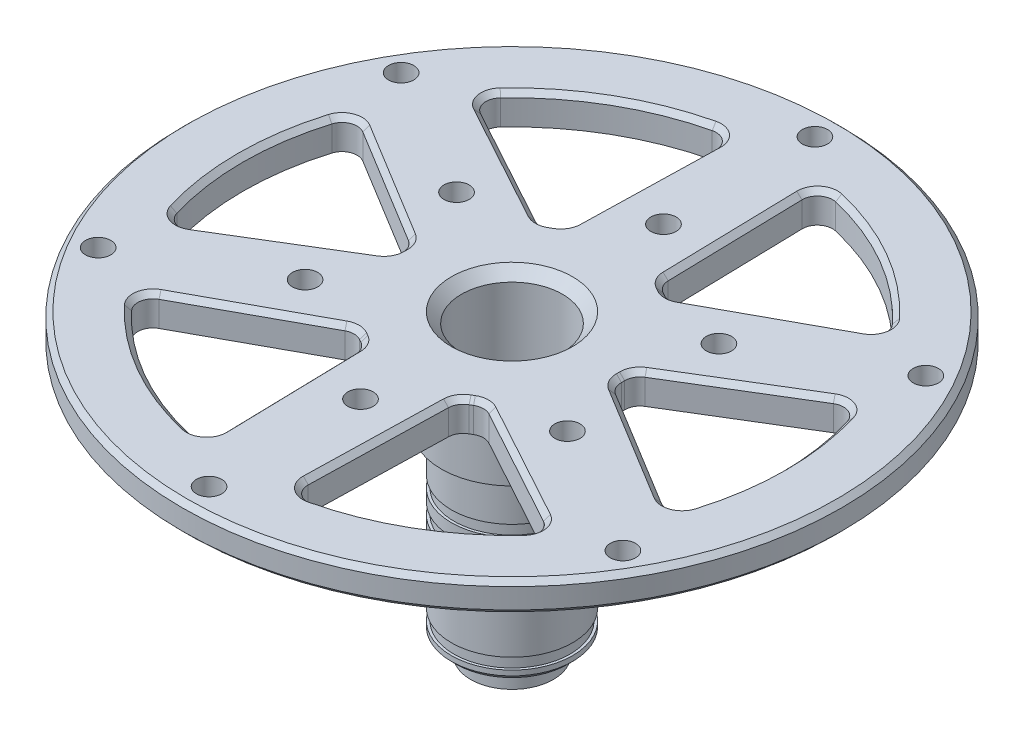
from build123d import *

# Parameters (mm, degrees)
CIRPATTERN1_COUNT        = 3
CHAMFER1_SIZE            = 0.5
CHAMFER2_SIZE            = 1
CUT_EXTRUDE1_DEPTH       = 51.319429647
FILLET1_R                = 1.5
M3X0_5_TAPPED_HOLE1_D    = 2.5
CIRPATTERN2_COUNT        = 6
FILLET1_OF_CIRPATTERN2_R = 1.5
SKETCH10_W               = 1.207732619
SKETCH10_H               = 1.1
SKETCH11_W               = 3.151954219
SKETCH11_H               = 1.1
M3X0_5_TAPPED_HOLE2_D    = 2.5
CIRPATTERN3_COUNT        = 6
CHAMFER3_SIZE            = 0.5


with BuildPart() as part:
    # Sketch2 → Revolve1 (revolve)
    with BuildSketch(Plane.XY):
        Polygon((-4, 10), (-4, -6.5), (-3.1, -6.5), (-3.1, -9.5), (-4.1, -9.5), (-4.1, -7.5), (-6, -7.5), (-6, 10), (-7, 10), (-7, 17), (-32.65, 17), (-32.65, 20), (-5, 20), (-5, 11), align=None)
    revolve(axis=Axis((0, 0, 0), (0, -1, 0)))

    # Sketch3 → Revolve2 (revolve)
    with BuildSketch(Plane.XY):
        Polygon((-21.598, 15), (-22.598, 15), (-22.598, 17), (-20.098, 17), (-20.098, 11), (-21.598, 11), align=None)
    revolve2 = revolve(axis=Axis((-20.098, 18.273035546, 0), (0, -1, 0)))

    # CirPattern1: Revolve2 ×3 about axis
    cirpattern1_axis = Axis((0, 0, 0), (0, 1, 0))
    for i in range(1, CIRPATTERN1_COUNT):
        add(revolve2.rotate(cirpattern1_axis, i * 360 / CIRPATTERN1_COUNT))

    # Chamfer1
    chamfer1_edges = [part.edges().sort_by_distance(p)[0] for p in [
        (32.65, 20, 0),
        (32.65, 17, 0),
    ]]
    chamfer(chamfer1_edges, length=CHAMFER1_SIZE)

    # Chamfer2
    chamfer2_edges = [part.edges().sort_by_distance(p)[0] for p in [
        (5, 20, 0),
    ]]
    chamfer(chamfer2_edges, length=CHAMFER2_SIZE)

    # Sketch6 → Cut-Extrude1 (cut, through all)
    with BuildSketch(Plane(origin=(0, 0, 0), x_dir=(1, 0, 0), z_dir=(0, 1, 0))):
        with BuildLine():
            Line((24.899246977, -9.5), (10.95445115, -1))
            ThreePointArc((10.95445115, -1), (11, 0), (10.95445115, 1))
            Line((10.95445115, 1), (24.899246977, 9.5))
            ThreePointArc((24.899246977, 9.5), (26.65, 0), (24.899246977, -9.5))
        make_face()
    cut_extrude1 = extrude(amount=CUT_EXTRUDE1_DEPTH, mode=Mode.SUBTRACT)

    # Fillet1
    fillet1_edges = [part.edges().sort_by_distance(p)[0] for p in [
        (24.899246977, 18.5, 9.5),
        (10.95445115, 18.5, 1),
        (10.95445115, 18.5, -1),
        (24.899246977, 18.5, -9.5),
    ]]
    fillet(fillet1_edges, radius=FILLET1_R)

    # M3x0.5 Tapped Hole1 (through all)
    with Locations(Plane(origin=(0, 20, 0), x_dir=(1, 0, 0), z_dir=(0, 1, 0))):
        with Locations((12.990381057, -7.5)):
            m3x0_5_tapped_hole1 = Hole(M3X0_5_TAPPED_HOLE1_D / 2)

    # CirPattern2: Cut-Extrude1, M3x0.5 Tapped Hole1 ×6 about axis
    cirpattern2_axis = Axis((0, 0, 0), (0, 1, 0))
    add([cut_extrude1.rotate(cirpattern2_axis, i * 360 / CIRPATTERN2_COUNT) for i in range(1, CIRPATTERN2_COUNT)], mode=Mode.SUBTRACT)
    add([m3x0_5_tapped_hole1.rotate(cirpattern2_axis, i * 360 / CIRPATTERN2_COUNT) for i in range(1, CIRPATTERN2_COUNT)], mode=Mode.SUBTRACT)

    # Fillet1 of CirPattern2
    fillet1_of_cirpattern2_edges = [part.edges().sort_by_distance(p)[0] for p in [
        (20.676864824, 18.5, -16.813380417),
        (6.343250979, 18.5, -8.986832981),
        (4.611200171, 18.5, -9.986832981),
        (4.222382152, 18.5, -26.313380417),
        (-4.222382152, 18.5, -26.313380417),
        (-4.611200171, 18.5, -9.986832981),
        (-6.343250979, 18.5, -8.986832981),
        (-20.676864824, 18.5, -16.813380417),
        (-24.899246977, 18.5, -9.5),
        (-10.95445115, 18.5, -1),
        (-10.95445115, 18.5, 1),
        (-24.899246977, 18.5, 9.5),
        (-20.676864824, 18.5, 16.813380417),
        (-6.343250979, 18.5, 8.986832981),
        (-4.611200171, 18.5, 9.986832981),
        (-4.222382152, 18.5, 26.313380417),
        (4.222382152, 18.5, 26.313380417),
        (4.611200171, 18.5, 9.986832981),
        (6.343250979, 18.5, 8.986832981),
        (20.676864824, 18.5, 16.813380417),
    ]]
    fillet(fillet1_of_cirpattern2_edges, radius=FILLET1_OF_CIRPATTERN2_R)

    # Sketch9 → Cut-Revolve1 (revolve, cut)
    with BuildSketch(Plane.XY):
        Polygon((-8.538708616, -5.4), (-5.75, -5.4), (-5.75, -6.5), (-6.5, -6.5), (-5.5, -7.5), (-8.538708616, -7.5), align=None)
    revolve(axis=Axis((0, 0, 0), (0, -1, 0)), mode=Mode.SUBTRACT)

    # Sketch10 → Cut-Revolve2 (revolve, cut)
    with BuildSketch(Plane.XY):
        with Locations((-6.35386631, 5.45)):
            Rectangle(SKETCH10_W, SKETCH10_H)
    revolve(axis=Axis((0, 0, 0), (0, 1, 0)), mode=Mode.SUBTRACT)

    # Sketch11 → Cut-Revolve3 (revolve, cut)
    with BuildSketch(Plane.XY):
        with Locations((-7.32597711, 3.15)):
            Rectangle(SKETCH11_W, SKETCH11_H)
    revolve(axis=Axis((0, 0, 0), (0, -1, 0)), mode=Mode.SUBTRACT)

    # M3x0.5 Tapped Hole2 (through all)
    with Locations(Plane(origin=(0, 20, 0), x_dir=(1, 0, 0), z_dir=(0, 1, 0))):
        with Locations((0, 30)):
            m3x0_5_tapped_hole2 = Hole(M3X0_5_TAPPED_HOLE2_D / 2)

    # CirPattern3: M3x0.5 Tapped Hole2 ×6 about axis
    cirpattern3_axis = Axis((0, 0, 0), (0, 1, 0))
    for i in range(1, CIRPATTERN3_COUNT):
        add(m3x0_5_tapped_hole2.rotate(cirpattern3_axis, i * 360 / CIRPATTERN3_COUNT), mode=Mode.SUBTRACT)

    # Chamfer3
    chamfer3_edges = [part.edges().sort_by_distance(p)[0] for p in [
        (-5.5, 20, -9.526279442),
        (-4.805155894, 20, -10.141501639),
        (-6.380220105, 20, -9.232137893),
        (-4.428403676, 20, -17.662494894),
        (-13.081967435, 20, -12.666357528),
        (-4.821376756, 20, -25.644815917),
        (-19.798373681, 20, -16.997842711),
        (-13.325, 20, -23.079577011),
        (11, 20, 0),
        (11.185375999, 20, 0.909363746),
        (11.185375999, 20, -0.909363746),
        (17.51037111, 20, 4.996137366),
        (17.51037111, 20, -4.996137366),
        (24.619750438, 20, 8.646973206),
        (24.619750438, 20, -8.646973206),
        (26.65, 20, 0),
        (5.5, 20, -9.526279442),
        (6.380220105, 20, -9.232137893),
        (4.805155894, 20, -10.141501639),
        (13.081967435, 20, -12.666357528),
        (4.428403676, 20, -17.662494894),
        (19.798373681, 20, -16.997842711),
        (4.821376756, 20, -25.644815917),
        (13.325, 20, -23.079577011),
        (-17.51037111, 20, -4.996137366),
        (-24.619750438, 20, -8.646973206),
        (-11.185375999, 20, -0.909363746),
        (-26.65, 20, 0),
        (-11, 20, 0),
        (-24.619750438, 20, 8.646973206),
        (-11.185375999, 20, 0.909363746),
        (-17.51037111, 20, 4.996137366),
        (-13.081967435, 20, 12.666357528),
        (-19.798373681, 20, 16.997842711),
        (-6.380220105, 20, 9.232137893),
        (-13.325, 20, 23.079577011),
        (-5.5, 20, 9.526279442),
        (-4.821376756, 20, 25.644815917),
        (-4.805155894, 20, 10.141501639),
        (-4.428403676, 20, 17.662494894),
        (13.081967435, 20, 12.666357528),
        (6.380220105, 20, 9.232137893),
        (19.798373681, 20, 16.997842711),
        (5.5, 20, 9.526279442),
        (13.325, 20, 23.079577011),
        (4.805155894, 20, 10.141501639),
        (4.821376756, 20, 25.644815917),
        (4.428403676, 20, 17.662494894),
    ]]
    chamfer(chamfer3_edges, length=CHAMFER3_SIZE)


solid = part.part
